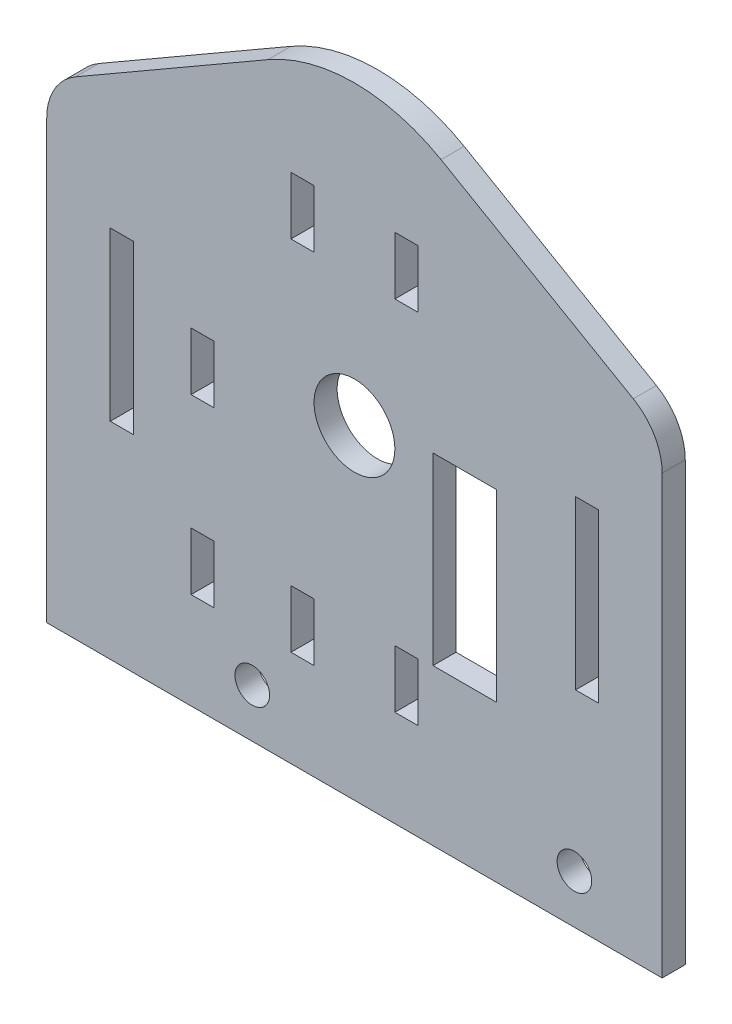
from build123d import *

# Parameters (mm, degrees)
SKETCH1_R           = 3.5
SKETCH1_R_2         = 1.5
SKETCH1_R_3         = 2.5
SKETCH1_W           = 2
SKETCH1_H           = 5
SKETCH1_W_2         = 5.5
SKETCH1_H_2         = 15.95
SKETCH1_H_3         = 14.5
BOSS_EXTRUDE1_DEPTH = 2
CUT_EXTRUDE_1_DEPTH = 10


with BuildPart() as part:
    # Sketch1 → Boss-Extrude1 (new body)
    with BuildSketch(Plane.XY):
        with BuildLine():
            Line((-25.65, 0), (25.65, 0))
            ThreePointArc((25.65, 0), (26.357106781, 0.292893219), (26.65, 1))
            Line((26.65, 1), (26.65, 99.754415082))
            ThreePointArc((26.65, 99.754415082), (25.980127019, 102.254415082), (24.15, 104.0845421))
            Line((24.15, 104.0845421), (7.5, 113.697424082))
            ThreePointArc((7.5, 113.697424082), (0, 115.707043026), (-7.5, 113.697424082))
            Line((-7.5, 113.697424082), (-24.15, 104.0845421))
            ThreePointArc((-24.15, 104.0845421), (-25.980127019, 102.254415082), (-26.65, 99.754415082))
            Line((-26.65, 99.754415082), (-26.65, 1))
            ThreePointArc((-26.65, 1), (-26.357106781, 0.292893219), (-25.65, 0))
        make_face()
        with Locations((0, 90)):
            Circle(SKETCH1_R, mode=Mode.SUBTRACT)
        with Locations((19.05, 66.1)):
            Circle(SKETCH1_R_2, mode=Mode.SUBTRACT)
        with Locations((-8.85, 66.1)):
            Circle(SKETCH1_R_2, mode=Mode.SUBTRACT)
        with Locations((-24.05, 15.3)):
            Circle(SKETCH1_R_2, mode=Mode.SUBTRACT)
        with Locations((24.15, 14)):
            Circle(SKETCH1_R_2, mode=Mode.SUBTRACT)
        with Locations((0, 34.3)):
            Circle(SKETCH1_R_3, mode=Mode.SUBTRACT)
        with Locations((4.5, 103.75)):
            Rectangle(SKETCH1_W, SKETCH1_H, mode=Mode.SUBTRACT)
        with Locations((9.55, 83.375)):
            Rectangle(SKETCH1_W_2, SKETCH1_H_2, mode=Mode.SUBTRACT)
        with Locations((20.15, 87)):
            Rectangle(SKETCH1_W, SKETCH1_H_3, mode=Mode.SUBTRACT)
        with Locations((4.5, 72.75)):
            Rectangle(SKETCH1_W, SKETCH1_H, mode=Mode.SUBTRACT)
        with Locations((-4.5, 72.75)):
            Rectangle(SKETCH1_W, SKETCH1_H, mode=Mode.SUBTRACT)
        with Locations((-20.15, 87)):
            Rectangle(SKETCH1_W, SKETCH1_H_3, mode=Mode.SUBTRACT)
        with Locations((-4.5, 103.75)):
            Rectangle(SKETCH1_W, SKETCH1_H, mode=Mode.SUBTRACT)
        with Locations((-13.15, 72.75)):
            Rectangle(SKETCH1_W, SKETCH1_H, mode=Mode.SUBTRACT)
        with Locations((-13.15, 87.75)):
            Rectangle(SKETCH1_W, SKETCH1_H, mode=Mode.SUBTRACT)
        Polygon((-20, 34.3), (-20, 36.05), (-7, 36.05), (-7, 34.3), (-7, 32.55), (-20, 32.55), align=None, mode=Mode.SUBTRACT)
        Polygon((-5.232050808, 39.362177826), (-15.732050808, 57.548711306), (-12.267949192, 59.548711306), (-1.767949192, 41.362177826), align=None, mode=Mode.SUBTRACT)
        Polygon((1.767949192, 41.362177826), (5.232050808, 39.362177826), (15.732050808, 57.548711306), (12.267949192, 59.548711306), align=None, mode=Mode.SUBTRACT)
        Polygon((7, 34.3), (7, 32.55), (20, 32.55), (20, 34.3), (20, 36.05), (7, 36.05), align=None, mode=Mode.SUBTRACT)
        Polygon((-1.767949192, 27.237822174), (-5.232050808, 29.237822174), (-15.732050808, 11.051288694), (-12.267949192, 9.051288694), align=None, mode=Mode.SUBTRACT)
        Polygon((15.732050808, 11.051288694), (12.267949192, 9.051288694), (1.767949192, 27.237822174), (5.232050808, 29.237822174), align=None, mode=Mode.SUBTRACT)
    extrude(amount=BOSS_EXTRUDE1_DEPTH)

    # 草图1 → 切除-拉伸1 (cut)
    with BuildSketch(Plane(origin=(0, 0, 0), x_dir=(-1, 0, 0), z_dir=(0, 0, -1))):
        Polygon((-26.65, 61.892241422), (26.65, 61.892241422), (26.65, 1), (26.65, 0), (-26.65, 0), align=None)
    extrude(amount=-CUT_EXTRUDE_1_DEPTH, mode=Mode.SUBTRACT)


solid = part.part
